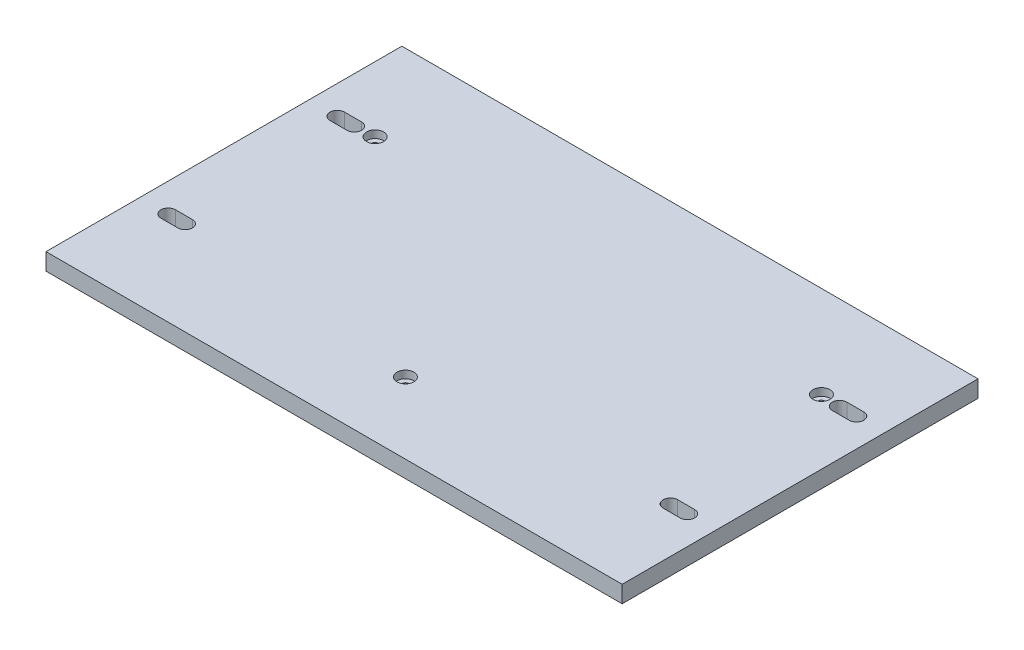
from build123d import *

# Parameters (mm, degrees)
SKETCH1_W      = 431.8
SKETCH1_H      = 266.7
EXTRUDE1_DEPTH = 12.7
SKETCH2_R      = 6.35
EXTRUDE2_DEPTH = 5.6642


with BuildPart() as part:
    # Sketch1 → Extrude1 (new body)
    with BuildSketch(Plane(origin=(0, 0, 0), x_dir=(1, 0, 0), z_dir=(0, 1, 0))):
        Rectangle(SKETCH1_W, SKETCH1_H)
        with BuildLine():
            Line((-194.564000001, 58.166), (-181.864, 58.166))
            ThreePointArc((-181.864, 58.166), (-176.403, 63.627), (-181.864, 69.088))
            Line((-181.864, 69.088), (-194.564, 69.088))
            ThreePointArc((-194.564, 69.088), (-200.025, 63.627000001), (-194.564000001, 58.166))
        make_face(mode=Mode.SUBTRACT)
        with BuildLine():
            Line((-181.864, -57.658), (-194.564, -57.658))
            ThreePointArc((-194.564, -57.658), (-200.025, -63.119), (-194.564000001, -68.58))
            Line((-194.564000001, -68.58), (-181.864, -68.58))
            ThreePointArc((-181.864, -68.58), (-176.403, -63.119), (-181.864, -57.658))
        make_face(mode=Mode.SUBTRACT)
        with BuildLine():
            Line((194.564, 69.088), (181.864, 69.088))
            ThreePointArc((181.864, 69.088), (176.403, 63.627), (181.864, 58.166))
            Line((181.864, 58.166), (194.564, 58.166))
            ThreePointArc((194.564, 58.166), (200.025, 63.627), (194.564, 69.088))
        make_face(mode=Mode.SUBTRACT)
        with BuildLine():
            Line((181.863999999, -68.58), (194.564, -68.58))
            ThreePointArc((194.564, -68.58), (200.025, -63.119), (194.564, -57.658))
            Line((194.564, -57.658), (181.864, -57.658))
            ThreePointArc((181.864, -57.658), (176.403, -63.118999999), (181.863999999, -68.58))
        make_face(mode=Mode.SUBTRACT)
        with BuildLine():
            ThreePointArc((-167.131999747, 67.283526113), (-169.905025875, 64.510499985), (-167.131999746, 61.737473858))
            ThreePointArc((-167.131999746, 61.737473858), (-164.358973618, 64.510499986), (-167.131999747, 67.283526113))
        make_face(mode=Mode.SUBTRACT)
        with BuildLine():
            ThreePointArc((0.167999917, -77.272489219), (-2.582000069, -80.022489206), (0.167999918, -82.772489192))
            ThreePointArc((0.167999918, -82.772489192), (2.917999904, -80.022489205), (0.167999917, -77.272489219))
        make_face(mode=Mode.SUBTRACT)
        with BuildLine():
            ThreePointArc((167.427999991, 67.323527583), (164.614972394, 64.510499985), (167.427999992, 61.697472388))
            ThreePointArc((167.427999992, 61.697472388), (170.241027589, 64.510499986), (167.427999991, 67.323527583))
        make_face(mode=Mode.SUBTRACT)
    extrude(amount=EXTRUDE1_DEPTH)

    # Sketch2 → Extrude2 (cut)
    with BuildSketch(Plane(origin=(0, 12.7, 0), x_dir=(1, 0, 0), z_dir=(0, 1, 0))):
        with Locations(Location((-167.131999747, 64.510499986, 0), (0, 0, 270))):
            Circle(SKETCH2_R)
        with Locations(Location((0.167999917, -80.022489205, 0), (0, 0, 270))):
            Circle(SKETCH2_R)
        with Locations(Location((167.427999991, 64.510499986, 0), (0, 0, 270))):
            Circle(SKETCH2_R)
    extrude(amount=-EXTRUDE2_DEPTH, mode=Mode.SUBTRACT)


solid = part.part
